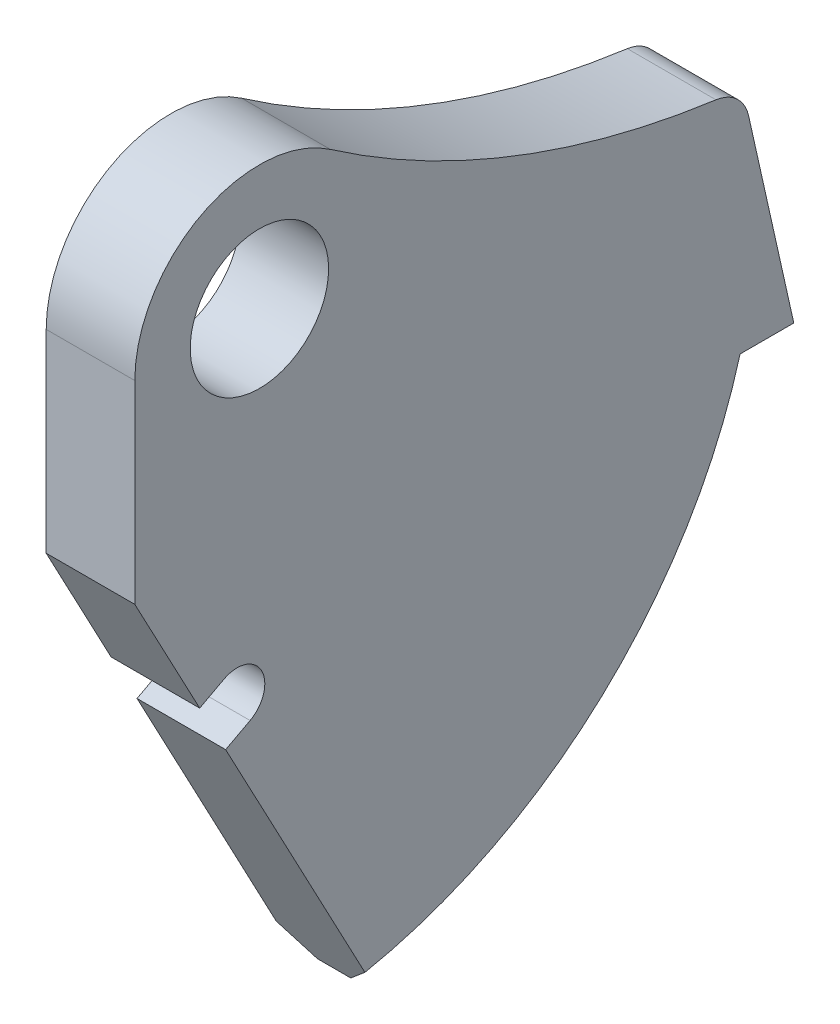
from build123d import *

# Parameters (mm, degrees)
SKETCH_1_R      = 12.5
EXTRUDE_1_DEPTH = 8
CHAMFER_1_SIZE  = 5


with BuildPart() as part:
    # 草图1 → 凸台-拉伸1 (new, symmetric)
    with BuildSketch(Plane(origin=(0, 0, 0), x_dir=(0, 0, -1), z_dir=(1, 0, 0))):
        with BuildLine():
            Line((-22.5, 0), (-22.5, -35))
            Line((-22.5, -35), (-10.783162242, -57.084286562))
            Line((-10.783162242, -57.084286562), (-6.36630493, -54.74091901))
            ThreePointArc((-6.36630493, -54.74091901), (0.393919934, -56.814408771), (-1.679569826, -63.574633635))
            Line((-1.679569826, -63.574633635), (-6.096427139, -65.918001187))
            Line((-6.096427139, -65.918001187), (21.5, -117.932667397))
            ThreePointArc((21.5, -117.932667397), (66.291252117, -94.19847395), (91.981942633, -50.5))
            Line((91.981942633, -50.5), (96.5, -50.5))
            Line((96.5, -50.5), (88.331264802, -13.972315085))
            ThreePointArc((88.331264802, -13.972315085), (86.235037436, -10.344476702), (82.442373664, -8.563723486))
            ThreePointArc((82.442373664, -8.563723486), (46.03018843, 0.843735432), (12.819740934, 18.490652838))
            ThreePointArc((12.819740934, 18.490652838), (-10.435655921, 19.933566803), (-22.5, 0))
        make_face()
        Circle(SKETCH_1_R, mode=Mode.SUBTRACT)
    extrude(amount=EXTRUDE_1_DEPTH, both=True)

    # 倒角1
    chamfer_1_edges = [part.edges().sort_by_distance(p)[0] for p in [
        (-8, -94.19847395, -66.291252117),
        (8, -94.19847395, -66.291252117),
    ]]
    chamfer(chamfer_1_edges, length=CHAMFER_1_SIZE)


solid = part.part
